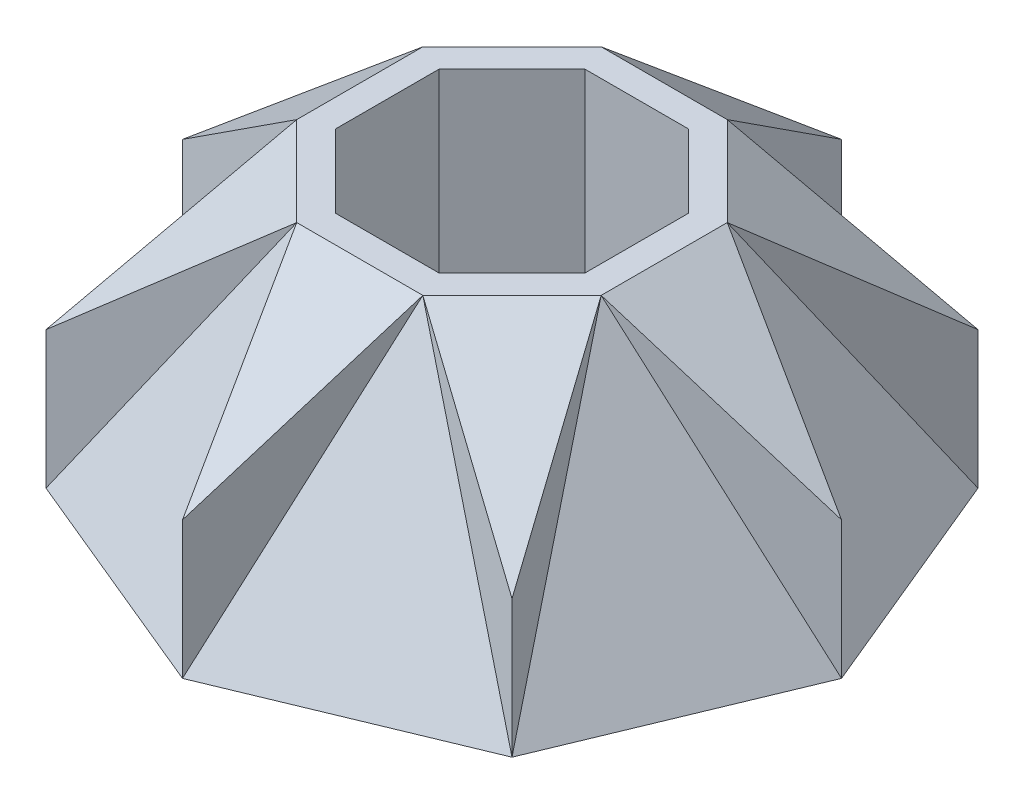
from build123d import *

# Parameters (mm, degrees)
EXTRUDE_2_DEPTH                 = 50
SKETCH_4_W                      = 120
SKETCH_4_H                      = 97.901728648
CUT_EXTRUDE_1_DEPTH             = 50
PATTERN_CIRCULAR_1_COUNT        = 8
EXTRUDE_3_DEPTH                 = 50
CUT_EXTRUDE_2_REACH             = 100.489
CUT_EXTRUDE_2_DIRECTION_2_REACH = 100.489
PATTERN_CIRCULAR_3_COUNT        = 8
EXTRUDE_4_DEPTH                 = 50


with BuildPart() as part:
    # 草图3 → 凸台-拉伸2 (new body)
    with BuildSketch(Plane(origin=(0, 0, 0), x_dir=(1, 0, 0), z_dir=(0, 1, 0))):
        Polygon((-42.426406871, -42.426406871), (0, -60), (42.426406871, -42.426406871), (60, 0), (42.426406871, 42.426406871), (0, 60), (-42.426406871, 42.426406871), (-60, 0), align=None)
        Polygon((27.716385975, -11.480502971), (11.480502971, -27.716385975), (-11.480502971, -27.716385975), (-27.716385975, -11.480502971), (-27.716385975, 11.480502971), (-11.480502971, 27.716385975), (11.480502971, 27.716385975), (27.716385975, 11.480502971), align=None, mode=Mode.SUBTRACT)
    extrude(amount=EXTRUDE_2_DEPTH)

    # 草图4 → 切除-拉伸1 (cut)
    with BuildSketch(Plane(origin=(-16.852857596, 22.400493343, 40.686397374), x_dir=(0.9400294128280147, 0.16450882670917247, 0.2988001823175307), z_dir=(-0.3410933933957357, 0.4533747611963636, 0.8234722963718466))):
        Rectangle(SKETCH_4_W, SKETCH_4_H)
    cut_extrude_1 = extrude(amount=CUT_EXTRUDE_1_DEPTH, mode=Mode.SUBTRACT)

    # 阵列(圆周)1: 切除-拉伸1 ×8 about axis
    pattern_circular_1_axis = Axis((0, 80.427502856, 0), (0, -1, 0))
    for i in range(1, PATTERN_CIRCULAR_1_COUNT):
        add(cut_extrude_1.rotate(pattern_circular_1_axis, i * 360 / PATTERN_CIRCULAR_1_COUNT), mode=Mode.SUBTRACT)

    # 草图5 → 凸台-拉伸3 (add)
    with BuildSketch(Plane(origin=(0, 0, 0), x_dir=(1, 0, 0), z_dir=(0, 1, 0))):
        Polygon((-27.716385975, 11.480502971), (-60, 0), (-27.716385975, -11.480502971), align=None)
    extrude_3 = extrude(amount=EXTRUDE_3_DEPTH)

    # 草图6 → 切除-拉伸2 (cut, up to next)
    with BuildSketch(Plane.XY, mode=Mode.PRIVATE) as cut_extrude_2_sk1:
        Polygon((-27.716385975, 50), (-60, 50), (-60, 25), align=None)
    cut_extrude_2_tool1 = extrude(cut_extrude_2_sk1.sketch, amount=-CUT_EXTRUDE_2_REACH, mode=Mode.PRIVATE) & part.part
    cut_extrude_2 = cut_extrude_2_tool1.solids().sort_by_distance((-49.238795, 41.666667, 0))[0]
    add(cut_extrude_2, mode=Mode.SUBTRACT)

    # 草图6 → 切除-拉伸2 direction 2 (cut, up to next)
    with BuildSketch(Plane.XY, mode=Mode.PRIVATE) as cut_extrude_2_direction_2_sk1:
        Polygon((-27.716385975, 50), (-60, 50), (-60, 25), align=None)
    cut_extrude_2_direction_2_tool1 = extrude(cut_extrude_2_direction_2_sk1.sketch, amount=CUT_EXTRUDE_2_DIRECTION_2_REACH, mode=Mode.PRIVATE) & part.part
    cut_extrude_2_direction_2 = cut_extrude_2_direction_2_tool1.solids().sort_by_distance((-49.238795, 41.666667, 0))[0]
    add(cut_extrude_2_direction_2, mode=Mode.SUBTRACT)

    # 阵列(圆周)3: 凸台-拉伸3, 切除-拉伸2, 切除-拉伸2 direction 2 ×8 about axis
    pattern_circular_3_axis = Axis((0, 80.427502856, 0), (0, -1, 0))
    add([extrude_3.rotate(pattern_circular_3_axis, i * 360 / PATTERN_CIRCULAR_3_COUNT) for i in range(1, PATTERN_CIRCULAR_3_COUNT)])
    add([cut_extrude_2.rotate(pattern_circular_3_axis, i * 360 / PATTERN_CIRCULAR_3_COUNT) for i in range(1, PATTERN_CIRCULAR_3_COUNT)], mode=Mode.SUBTRACT)
    add([cut_extrude_2_direction_2.rotate(pattern_circular_3_axis, i * 360 / PATTERN_CIRCULAR_3_COUNT) for i in range(1, PATTERN_CIRCULAR_3_COUNT)], mode=Mode.SUBTRACT)

    # 草图3<4> → 凸台-拉伸4 (add)
    with BuildSketch(Plane(origin=(0, 0, 0), x_dir=(1, 0, 0), z_dir=(0, 1, 0))):
        Polygon((-11.480502971, -27.716385975), (11.480502971, -27.716385975), (27.716385975, -11.480502971), (27.716385975, 11.480502971), (11.480502971, 27.716385975), (-11.480502971, 27.716385975), (-27.716385975, 11.480502971), (-27.716385975, -11.480502971), align=None)
        Polygon((-22.716385975, 9.409435159), (-9.409435159, 22.716385975), (9.409435159, 22.716385975), (22.716385975, 9.409435159), (22.716385975, -9.409435159), (9.409435159, -22.716385975), (-9.409435159, -22.716385975), (-22.716385975, -9.409435159), align=None, mode=Mode.SUBTRACT)
    extrude(amount=EXTRUDE_4_DEPTH)


solid = part.part
